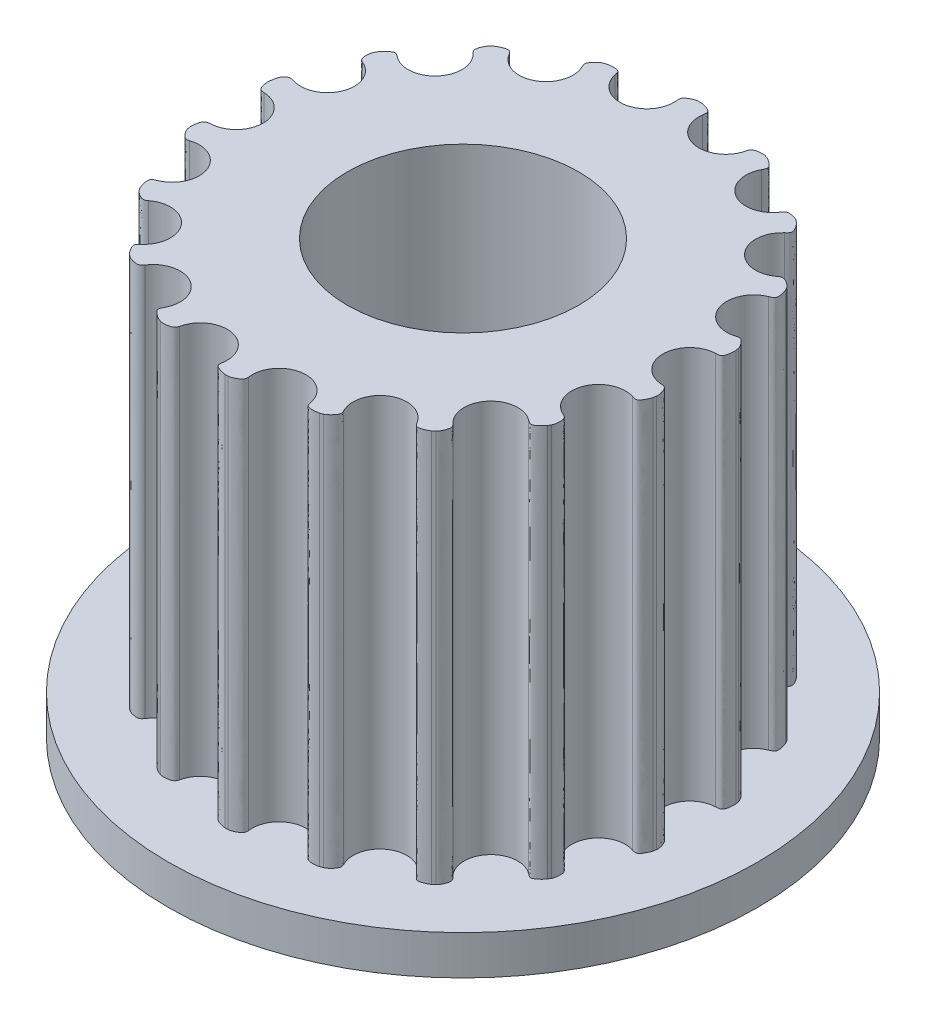
from build123d import *

# Parameters (mm, degrees)
BOSS_EXTRUDE1_DEPTH     = 11
SKETCH3_R               = 7.5
BOSS_EXTRUDE2_DEPTH     = 1
CUT_EXTRUDE1_DEPTH      = 16.280706888
CUT_EXTRUDE1_DEPTH_BACK = 16.280706888
SKETCH4_R               = 2.945


with BuildPart() as part:
    # Sketch2 → Boss-Extrude1 (new body)
    with BuildSketch(Plane(origin=(0, 0, 0), x_dir=(1, 0, 0), z_dir=(0, 1, 0))):
        with BuildLine():
            Line((-5.23546521, 2.977929759), (-5.196695427, 3.045080993))
            add(Edge.make_bspline(
                [(-4.842851848, 3.16980626), (-4.91356892, 3.225062362), (-4.996714388, 3.270326424), (-5.173342741, 3.084660394), (-5.196695427, 3.045080993)],
                knots=[0, 0, 0, 0, 0.389028599, 1, 1, 1, 1], degree=3))
            ThreePointArc((-4.842851848, 3.16980626), (-3.898206243, 3.270983421), (-3.962602179, 4.218846966))
            add(Edge.make_bspline(
                [(-3.962602179, 4.218846966), (-4.028816918, 4.279425421), (-4.015139275, 4.420060184), (-3.936376504, 4.559382301), (-3.901216061, 4.588973181)],
                knots=[0, 0, 0, 0, 0.389028599, 1, 1, 1, 1], degree=3))
            Line((-3.901216061, 4.588973181), (-3.841817307, 4.638814653))
            add(Edge.make_bspline(
                [(-3.466654554, 4.634996435), (-3.514208164, 4.711106849), (-3.576858126, 4.782078579), (-3.806336008, 4.668020035), (-3.841817307, 4.638814653)],
                knots=[0, 0, 0, 0, 0.389028599, 1, 1, 1, 1], degree=3))
            ThreePointArc((-3.466654554, 4.634996435), (-2.544373423, 4.406984042), (-2.280697382, 5.319709127))
            add(Edge.make_bspline(
                [(-2.280697382, 5.319709127), (-2.322199833, 5.399281029), (-2.261247131, 5.526756448), (-2.139583365, 5.63073796), (-2.09642268, 5.646518712)],
                knots=[0, 0, 0, 0, 0.389028599, 1, 1, 1, 1], degree=3))
            Line((-2.09642268, 5.646518712), (-2.023559322, 5.673038805))
            add(Edge.make_bspline(
                [(-1.672327558, 5.541137635), (-1.69098204, 5.628922322), (-1.725579986, 5.717041482), (-1.980228978, 5.688347568), (-2.023559322, 5.673038805)],
                knots=[0, 0, 0, 0, 0.389028599, 1, 1, 1, 1], degree=3))
            ThreePointArc((-1.672327558, 5.541137635), (-0.883651616, 5.011437346), (-0.323706822, 5.778935857))
            add(Edge.make_bspline(
                [(-0.323706822, 5.778935857), (-0.335491176, 5.86790366), (-0.23461521, 5.966844319), (-0.084724896, 6.02294352), (-0.038769783, 6.023010752)],
                knots=[0, 0, 0, 0, 0.389028599, 1, 1, 1, 1], degree=3))
            Line((-0.038769783, 6.023010752), (0.038769783, 6.023010752))
            add(Edge.make_bspline(
                [(0.323706822, 5.778935857), (0.336201474, 5.867806688), (0.333828568, 5.962444807), (0.084722893, 6.022576433), (0.038769783, 6.023010752)],
                knots=[0, 0, 0, 0, 0.389028599, 1, 1, 1, 1], degree=3))
            ThreePointArc((0.323706822, 5.778935857), (0.883651616, 5.011437346), (1.672327558, 5.541137635))
            add(Edge.make_bspline(
                [(1.672327558, 5.541137635), (1.691682669, 5.628770509), (1.820314768, 5.687242704), (1.980352647, 5.688693202), (2.023559322, 5.673038805)],
                knots=[0, 0, 0, 0, 0.389028599, 1, 1, 1, 1], degree=3))
            Line((2.023559322, 5.673038805), (2.09642268, 5.646518712))
            add(Edge.make_bspline(
                [(2.280697382, 5.319709127), (2.322834129, 5.398946969), (2.352972469, 5.488689293), (2.139455932, 5.630393696), (2.09642268, 5.646518712)],
                knots=[0, 0, 0, 0, 0.389028599, 1, 1, 1, 1], degree=3))
            ThreePointArc((2.280697382, 5.319709127), (2.544373423, 4.406984042), (3.466654554, 4.634996435))
            add(Edge.make_bspline(
                [(3.466654554, 4.634996435), (3.514814617, 4.710724562), (3.65568792, 4.721675683), (3.806570433, 4.668302528), (3.841817307, 4.638814653)],
                knots=[0, 0, 0, 0, 0.389028599, 1, 1, 1, 1], degree=3))
            Line((3.841817307, 4.638814653), (3.901216061, 4.588973181))
            add(Edge.make_bspline(
                [(3.962602179, 4.218846966), (4.029298706, 4.278894565), (4.088313165, 4.352916845), (3.93613901, 4.559102384), (3.901216061, 4.588973181)],
                knots=[0, 0, 0, 0, 0.389028599, 1, 1, 1, 1], degree=3))
            ThreePointArc((3.962602179, 4.218846966), (3.898206243, 3.270983421), (4.842851848, 3.16980626))
            add(Edge.make_bspline(
                [(4.842851848, 3.16980626), (4.914008049, 3.224495711), (5.050131156, 3.186604891), (5.173659646, 3.084845672), (5.196695427, 3.045080993)],
                knots=[0, 0, 0, 0, 0.389028599, 1, 1, 1, 1], degree=3))
            Line((5.196695427, 3.045080993), (5.23546521, 2.977929759))
            add(Edge.make_bspline(
                [(5.16655867, 2.609129597), (5.249770394, 2.642744327), (5.330542956, 2.692118384), (5.258065633, 2.937916039), (5.23546521, 2.977929759)],
                knots=[0, 0, 0, 0, 0.389028599, 1, 1, 1, 1], degree=3))
            ThreePointArc((5.16655867, 2.609129597), (4.78185786, 1.740453925), (5.634929736, 1.322290669))
            add(Edge.make_bspline(
                [(5.634929736, 1.322290669), (5.720499587, 1.349345088), (5.835454043, 1.26718252), (5.916729151, 1.129310901), (5.924775383, 1.084065624)],
                knots=[0, 0, 0, 0, 0.389028599, 1, 1, 1, 1], degree=3))
            Line((5.924775383, 1.084065624), (5.938239987, 1.007704058))
            add(Edge.make_bspline(
                [(5.747351936, 0.684712692), (5.837042293, 0.68784012), (5.929830596, 0.706610714), (5.94579194, 0.962373661), (5.938239987, 1.007704058)],
                knots=[0, 0, 0, 0, 0.389028599, 1, 1, 1, 1], degree=3))
            ThreePointArc((5.747351936, 0.684712692), (5.088746845, 0), (5.747351936, -0.684712692))
            add(Edge.make_bspline(
                [(5.747351936, -0.684712692), (5.83701445, -0.688556467), (5.91693505, -0.805080765), (5.946153798, -0.962435432), (5.938239987, -1.007704058)],
                knots=[0, 0, 0, 0, 0.389028599, 1, 1, 1, 1], degree=3))
            Line((5.938239987, -1.007704058), (5.924775383, -1.084065624))
            add(Edge.make_bspline(
                [(5.634929736, -1.322290669), (5.720280747, -1.350027757), (5.813893151, -1.364124637), (5.916367988, -1.129245184), (5.924775383, -1.084065624)],
                knots=[0, 0, 0, 0, 0.389028599, 1, 1, 1, 1], degree=3))
            ThreePointArc((5.634929736, -1.322290669), (4.78185786, -1.740453925), (5.16655867, -2.609129597))
            add(Edge.make_bspline(
                [(5.16655867, -2.609129597), (5.249499224, -2.643407949), (5.284746366, -2.780239428), (5.258384542, -2.938097848), (5.23546521, -2.977929759)],
                knots=[0, 0, 0, 0, 0.389028599, 1, 1, 1, 1], degree=3))
            Line((5.23546521, -2.977929759), (5.196695427, -3.045080993))
            add(Edge.make_bspline(
                [(4.842851848, -3.16980626), (4.91356892, -3.225062362), (4.996714388, -3.270326424), (5.173342741, -3.084660394), (5.196695427, -3.045080993)],
                knots=[0, 0, 0, 0, 0.389028599, 1, 1, 1, 1], degree=3))
            ThreePointArc((4.842851848, -3.16980626), (3.898206243, -3.270983421), (3.962602179, -4.218846966))
            add(Edge.make_bspline(
                [(3.962602179, -4.218846966), (4.028816918, -4.279425421), (4.015139275, -4.420060184), (3.936376504, -4.559382301), (3.901216061, -4.588973181)],
                knots=[0, 0, 0, 0, 0.389028599, 1, 1, 1, 1], degree=3))
            Line((3.901216061, -4.588973181), (3.841817307, -4.638814653))
            add(Edge.make_bspline(
                [(3.466654554, -4.634996435), (3.514208164, -4.711106849), (3.576858126, -4.782078579), (3.806336008, -4.668020035), (3.841817307, -4.638814653)],
                knots=[0, 0, 0, 0, 0.389028599, 1, 1, 1, 1], degree=3))
            ThreePointArc((3.466654554, -4.634996435), (2.544373423, -4.406984042), (2.280697382, -5.319709127))
            add(Edge.make_bspline(
                [(2.280697382, -5.319709127), (2.322199833, -5.399281029), (2.261247131, -5.526756448), (2.139583365, -5.63073796), (2.09642268, -5.646518712)],
                knots=[0, 0, 0, 0, 0.389028599, 1, 1, 1, 1], degree=3))
            Line((2.09642268, -5.646518712), (2.023559322, -5.673038805))
            add(Edge.make_bspline(
                [(1.672327558, -5.541137635), (1.69098204, -5.628922322), (1.725579986, -5.717041482), (1.980228978, -5.688347568), (2.023559322, -5.673038805)],
                knots=[0, 0, 0, 0, 0.389028599, 1, 1, 1, 1], degree=3))
            ThreePointArc((1.672327558, -5.541137635), (0.883651616, -5.011437346), (0.323706822, -5.778935857))
            add(Edge.make_bspline(
                [(0.323706822, -5.778935857), (0.335491176, -5.86790366), (0.23461521, -5.966844319), (0.084724896, -6.02294352), (0.038769783, -6.023010752)],
                knots=[0, 0, 0, 0, 0.389028599, 1, 1, 1, 1], degree=3))
            Line((0.038769783, -6.023010752), (-0.038769783, -6.023010752))
            add(Edge.make_bspline(
                [(-0.323706822, -5.778935857), (-0.336201474, -5.867806688), (-0.333828568, -5.962444807), (-0.084722893, -6.022576433), (-0.038769783, -6.023010752)],
                knots=[0, 0, 0, 0, 0.389028599, 1, 1, 1, 1], degree=3))
            ThreePointArc((-0.323706822, -5.778935857), (-0.883651616, -5.011437346), (-1.672327558, -5.541137635))
            add(Edge.make_bspline(
                [(-1.672327558, -5.541137635), (-1.691682669, -5.628770509), (-1.820314768, -5.687242704), (-1.980352647, -5.688693202), (-2.023559322, -5.673038805)],
                knots=[0, 0, 0, 0, 0.389028599, 1, 1, 1, 1], degree=3))
            Line((-2.023559322, -5.673038805), (-2.09642268, -5.646518712))
            add(Edge.make_bspline(
                [(-2.280697382, -5.319709127), (-2.322834129, -5.398946969), (-2.352972469, -5.488689293), (-2.139455932, -5.630393696), (-2.09642268, -5.646518712)],
                knots=[0, 0, 0, 0, 0.389028599, 1, 1, 1, 1], degree=3))
            ThreePointArc((-2.280697382, -5.319709127), (-2.544373423, -4.406984042), (-3.466654554, -4.634996435))
            add(Edge.make_bspline(
                [(-3.466654554, -4.634996435), (-3.514814617, -4.710724562), (-3.65568792, -4.721675683), (-3.806570433, -4.668302528), (-3.841817307, -4.638814653)],
                knots=[0, 0, 0, 0, 0.389028599, 1, 1, 1, 1], degree=3))
            Line((-3.841817307, -4.638814653), (-3.901216061, -4.588973181))
            add(Edge.make_bspline(
                [(-3.962602179, -4.218846966), (-4.029298706, -4.278894565), (-4.088313165, -4.352916845), (-3.93613901, -4.559102384), (-3.901216061, -4.588973181)],
                knots=[0, 0, 0, 0, 0.389028599, 1, 1, 1, 1], degree=3))
            ThreePointArc((-3.962602179, -4.218846966), (-3.898206243, -3.270983421), (-4.842851848, -3.16980626))
            add(Edge.make_bspline(
                [(-4.842851848, -3.16980626), (-4.914008049, -3.224495711), (-5.050131156, -3.186604891), (-5.173659646, -3.084845672), (-5.196695427, -3.045080993)],
                knots=[0, 0, 0, 0, 0.389028599, 1, 1, 1, 1], degree=3))
            Line((-5.196695427, -3.045080993), (-5.23546521, -2.977929759))
            add(Edge.make_bspline(
                [(-5.16655867, -2.609129597), (-5.249770394, -2.642744327), (-5.330542956, -2.692118384), (-5.258065633, -2.937916039), (-5.23546521, -2.977929759)],
                knots=[0, 0, 0, 0, 0.389028599, 1, 1, 1, 1], degree=3))
            ThreePointArc((-5.16655867, -2.609129597), (-4.78185786, -1.740453925), (-5.634929736, -1.322290669))
            add(Edge.make_bspline(
                [(-5.634929736, -1.322290669), (-5.720499587, -1.349345088), (-5.835454043, -1.26718252), (-5.916729151, -1.129310901), (-5.924775383, -1.084065624)],
                knots=[0, 0, 0, 0, 0.389028599, 1, 1, 1, 1], degree=3))
            Line((-5.924775383, -1.084065624), (-5.938239987, -1.007704058))
            add(Edge.make_bspline(
                [(-5.747351936, -0.684712692), (-5.837065571, -0.688201208), (-5.920672052, -0.755110275), (-5.945939277, -0.962333367), (-5.938239987, -1.007704058)],
                knots=[0, 0, 0, 0, 0.389028599, 1, 1, 1, 1], degree=3))
            ThreePointArc((-5.747351936, -0.684712692), (-5.088746845, 0), (-5.747351936, 0.684712692))
            add(Edge.make_bspline(
                [(-5.747351936, 0.684712692), (-5.837065571, 0.688201208), (-5.920672052, 0.755110275), (-5.945939277, 0.962333367), (-5.938239987, 1.007704058)],
                knots=[0, 0, 0, 0, 0.389028599, 1, 1, 1, 1], degree=3))
            Line((-5.938239987, 1.007704058), (-5.924775383, 1.084065624))
            add(Edge.make_bspline(
                [(-5.634929736, 1.322290669), (-5.878238597, 1.400289023), (-5.924775383, 1.084065624)],
                knots=[0, 0, 0, 1, 1, 1], degree=2))
            ThreePointArc((-5.634929736, 1.322290669), (-4.78185786, 1.740453925), (-5.16655867, 2.609129597))
            add(Edge.make_bspline(
                [(-5.16655867, 2.609129597), (-5.249499224, 2.643407949), (-5.284746366, 2.780239428), (-5.258384542, 2.938097848), (-5.23546521, 2.977929759)],
                knots=[0, 0, 0, 0, 0.389028599, 1, 1, 1, 1], degree=3))
        make_face()
    extrude(amount=BOSS_EXTRUDE1_DEPTH)

    # Sketch3 → Boss-Extrude2 (add)
    with BuildSketch(Plane.XZ):
        with Locations(Location((0, 0, 0), (0, 0, 270))):
            Circle(SKETCH3_R)
    extrude(amount=-BOSS_EXTRUDE2_DEPTH)

    # Sketch4 → Cut-Extrude1 (cut, two sides: drawn at the far end of the back side and taken through both)
    with BuildSketch(Plane(origin=(0, 11, 0), x_dir=(1, 0, 0), z_dir=(0, 1, 0)).offset(-CUT_EXTRUDE1_DEPTH_BACK)):
        with Locations(Location((0, 0, 0), (0, 0, 270))):
            Circle(SKETCH4_R)
    extrude(amount=CUT_EXTRUDE1_DEPTH + CUT_EXTRUDE1_DEPTH_BACK, mode=Mode.SUBTRACT)


solid = part.part
